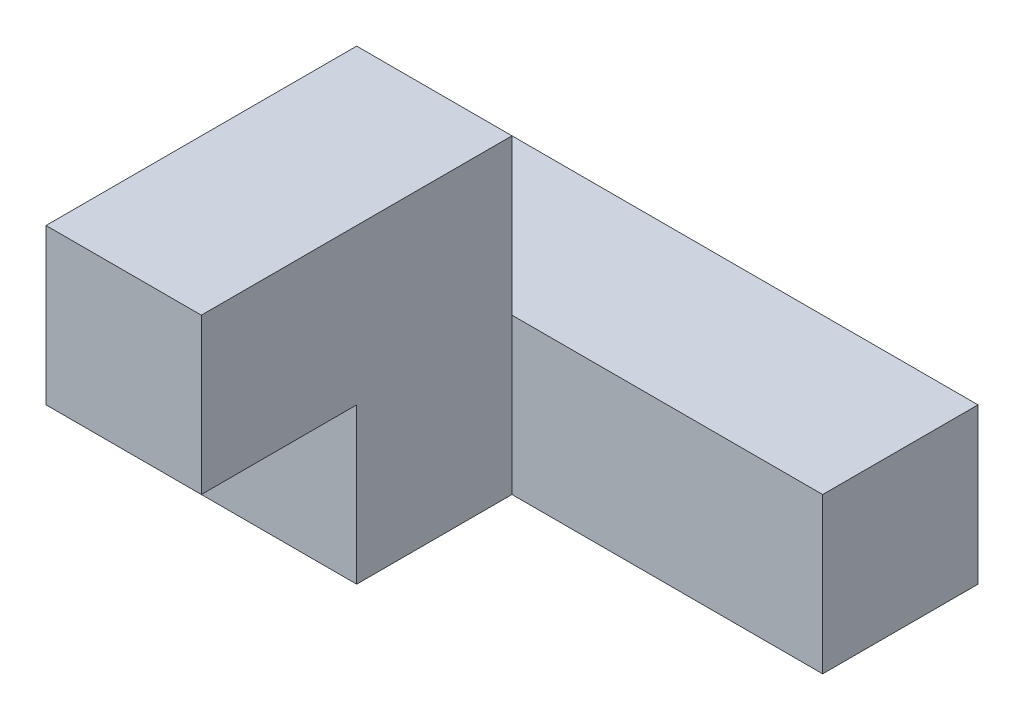
from build123d import *

# Parameters (mm, degrees)
SKETCH1_W           = 25.4
SKETCH1_H           = 50.8
BOSS_EXTRUDE1_DEPTH = 25.4
SKETCH2_W           = 25.4
SKETCH2_H           = 25.4
BOSS_EXTRUDE2_DEPTH = 50.8
SKETCH3_W           = 25.4
SKETCH3_H           = 25.4
BOSS_EXTRUDE3_DEPTH = 25.4
SKETCH4_W           = 25.4
SKETCH4_H           = 25.4
BOSS_EXTRUDE4_DEPTH = 25.4


with BuildPart() as part:
    # Sketch1 → Boss-Extrude1 (new body)
    with BuildSketch(Plane(origin=(0, 0, 0), x_dir=(1, 0, 0), z_dir=(0, 1, 0))):
        with Locations((12.7, 25.4)):
            Rectangle(SKETCH1_W, SKETCH1_H)
    extrude(amount=BOSS_EXTRUDE1_DEPTH)

    # Sketch2 → Boss-Extrude2 (add)
    with BuildSketch(Plane(origin=(25.4, 0, 0), x_dir=(0, 0, -1), z_dir=(1, 0, 0))):
        with Locations((38.1, 12.7)):
            Rectangle(SKETCH2_W, SKETCH2_H)
    extrude(amount=BOSS_EXTRUDE2_DEPTH)

    # Sketch3 → Boss-Extrude3 (add)
    with BuildSketch(Plane(origin=(0, 25.4, 0), x_dir=(1, 0, 0), z_dir=(0, 1, 0))):
        with Locations((12.7, 12.7)):
            Rectangle(SKETCH3_W, SKETCH3_H)
    extrude(amount=BOSS_EXTRUDE3_DEPTH)

    # Sketch4 → Boss-Extrude4 (add)
    with BuildSketch(Plane.XY):
        with Locations((12.7, 38.1)):
            Rectangle(SKETCH4_W, SKETCH4_H)
    extrude(amount=BOSS_EXTRUDE4_DEPTH)


solid = part.part
